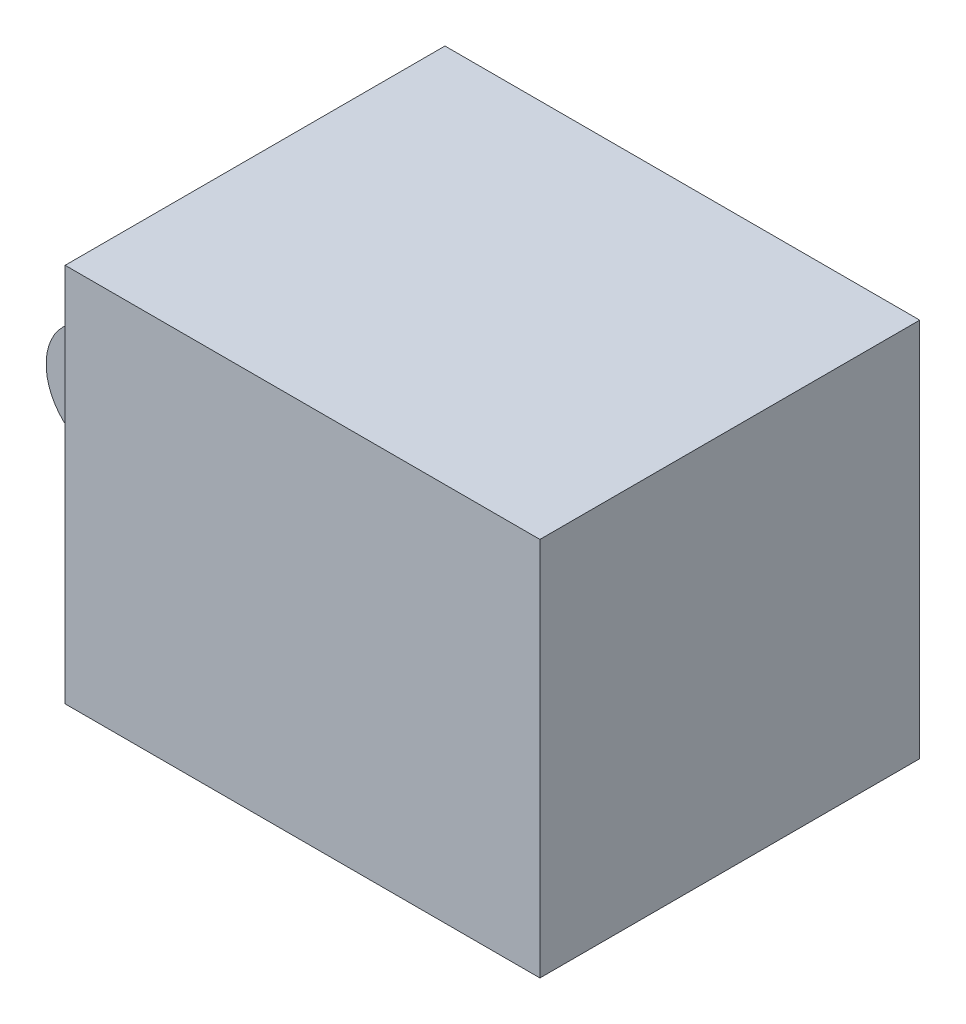
from build123d import *

# Parameters (mm, degrees)
BOSS_EXTRUDE1_DEPTH = 40
BOSS_EXTRUDE2_START = -10
SKETCH1_3_R         = 6
BOSS_EXTRUDE2_DEPTH = 40


with BuildPart() as part:
    # Sketch1 → Boss-Extrude1 (new body)
    with BuildSketch(Plane.XY):
        Polygon((56, 20), (6, 20), (6, 0), (6, -20), (56, -20), align=None)
    extrude(amount=BOSS_EXTRUDE1_DEPTH)


with BuildPart() as body_2:
    # Sketch1<3> → Boss-Extrude2 (new body)
    with BuildSketch(Plane.XY.offset(BOSS_EXTRUDE2_START)):
        Circle(SKETCH1_3_R)
    extrude(amount=BOSS_EXTRUDE2_DEPTH)


solid = Compound([part.part, body_2.part])
